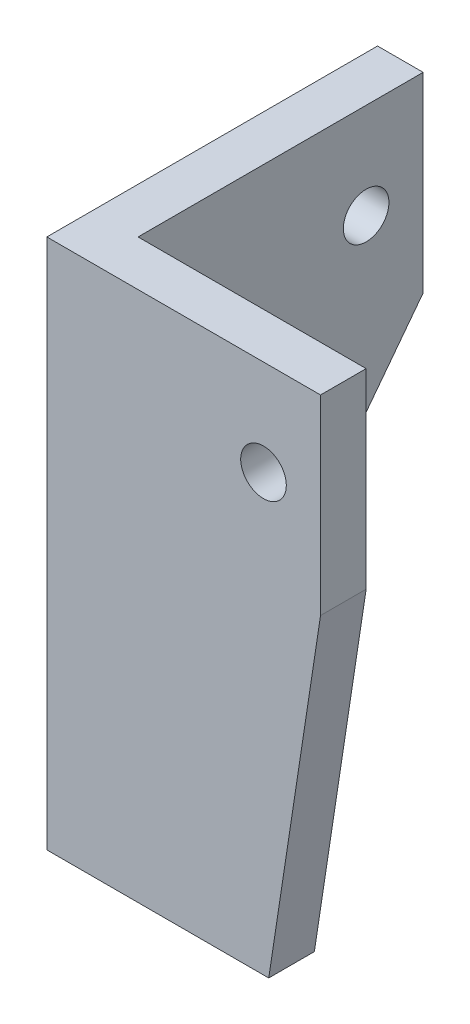
from build123d import *

# Parameters (mm, degrees)
BOSS_EXTRUDE1_DEPTH = 4
BOSS_EXTRUDE2_DEPTH = 4
CUT_EXTRUDE1_DEPTH  = 111.599740054
SKETCH4_R           = 2
CUT_EXTRUDE2_DEPTH  = 4
SKETCH5_R           = 2
CUT_EXTRUDE3_DEPTH  = 4


with BuildPart() as part:
    # Sketch1 → Boss-Extrude1 (new body)
    with BuildSketch(Plane.XY):
        Polygon((-90, -50.55), (-75, -50.55), (-70, -17.75), (-70, -1), (-80, -1), (-90, -1), (-90, -17.75), align=None)
    extrude(amount=BOSS_EXTRUDE1_DEPTH)

    # Sketch2 → Boss-Extrude2 (add)
    with BuildSketch(Plane.ZY.offset(90)):
        Polygon((0, -1), (-25, -1), (-25, -17.75), (0, -50.55), (4, -50.55), (4, -1), align=None)
    extrude(amount=BOSS_EXTRUDE2_DEPTH)

    # Sketch3 → Cut-Extrude1 (cut, through all)
    with BuildSketch(Plane.XY.offset(4)):
        Polygon((-94, -49.55), (-94, -50.55), (-75, -50.55), (-74.542682927, -47.55), (-94, -47.55), align=None)
    extrude(amount=-CUT_EXTRUDE1_DEPTH, mode=Mode.SUBTRACT)

    # Sketch4 → Cut-Extrude2 (cut)
    with BuildSketch(Plane.XY.offset(4)):
        with Locations((-75, -9.375)):
            Circle(SKETCH4_R)
    extrude(amount=-CUT_EXTRUDE2_DEPTH, mode=Mode.SUBTRACT)

    # Sketch5 → Cut-Extrude3 (cut)
    with BuildSketch(Plane.ZY.offset(94)):
        with Locations((-20, -9.375)):
            Circle(SKETCH5_R)
    extrude(amount=-CUT_EXTRUDE3_DEPTH, mode=Mode.SUBTRACT)


solid = part.part
